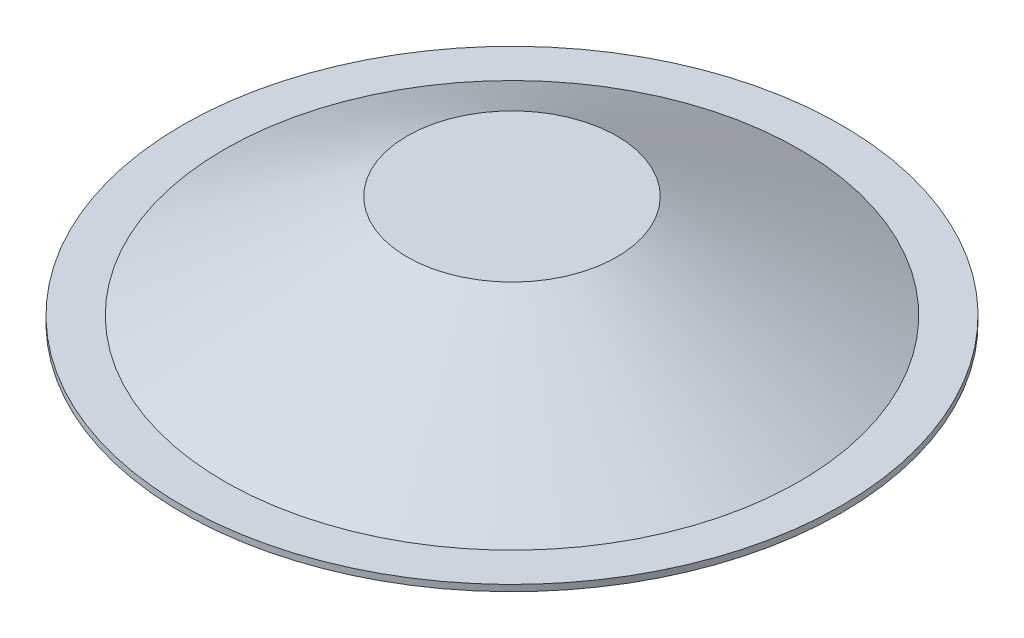
from build123d import *


with BuildPart() as part:
    # Sketch4 → Revolve5 (revolve)
    with BuildSketch(Plane.XY):
        Polygon((0, 0), (0, -3), (-49.213011226, -3), (-136.335815882, -52.087848892), (-157.122804656, -52.087848892), (-157.122804656, -49.087848892), (-137.122804656, -49.087848892), (-50, 0), align=None)
    revolve(axis=Axis((0, 0, 0), (0, -1, 0)))


solid = part.part
